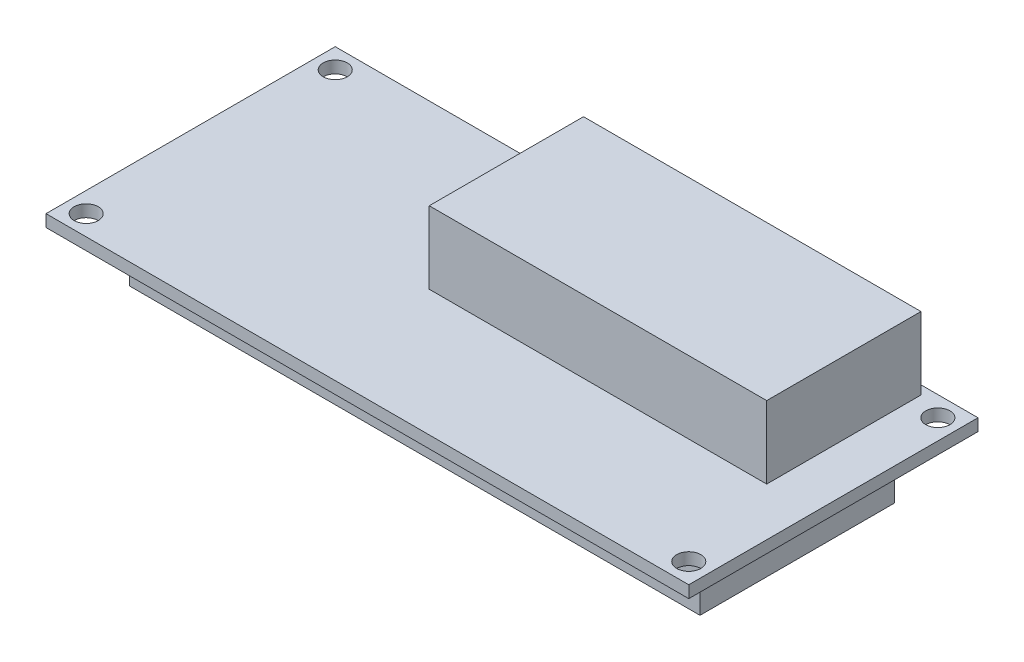
from build123d import *

# Parameters (mm, degrees)
SKETCH_1_W          = 80
SKETCH_1_H          = 36
SKETCH_1_R          = 1.5
EXTRUDE_1_DEPTH     = 1.5
SKETCH_2_W          = 71
SKETCH_2_H          = 24.2
EXTRUDE_2_DEPTH     = 7
SKETCH_3_W          = 42
SKETCH_3_H          = 19.2
EXTRUDE_3_DEPTH     = 9
SKETCH_4_W          = 64.4
SKETCH_4_H          = 14.5
CUT_EXTRUDE_1_DEPTH = 0.1


with BuildPart() as part:
    # Эскиз1 → Бобышка-Вытянуть1 (new body)
    with BuildSketch(Plane(origin=(0, 0, 0), x_dir=(1, 0, 0), z_dir=(0, 1, 0))):
        with Locations((16.363636364, -7.454545455)):
            Rectangle(SKETCH_1_W, SKETCH_1_H)
        with Locations(Location((-21.136363636, -22.954545455, 0), (0, 0, 270))):
            Circle(SKETCH_1_R, mode=Mode.SUBTRACT)
        with Locations(Location((53.863636364, 8.045454545, 0), (0, 0, 270))):
            Circle(SKETCH_1_R, mode=Mode.SUBTRACT)
        with Locations(Location((-21.136363636, 8.045454545, 0), (0, 0, 270))):
            Circle(SKETCH_1_R, mode=Mode.SUBTRACT)
        with Locations(Location((53.863636364, -22.954545455, 0), (0, 0, 270))):
            Circle(SKETCH_1_R, mode=Mode.SUBTRACT)
    extrude(amount=EXTRUDE_1_DEPTH)

    # Эскиз2 → Бобышка-Вытянуть2 (add)
    with BuildSketch(Plane.XZ):
        with Locations((16.363636364, 7.454545455)):
            Rectangle(SKETCH_2_W, SKETCH_2_H)
    extrude(amount=EXTRUDE_2_DEPTH)

    # Эскиз3 → Бобышка-Вытянуть3 (add)
    with BuildSketch(Plane(origin=(0, 1.5, 0), x_dir=(1, 0, 0), z_dir=(0, 1, 0))):
        with Locations((29.363636364, -0.154545455)):
            Rectangle(SKETCH_3_W, SKETCH_3_H)
    extrude(amount=EXTRUDE_3_DEPTH)

    # Эскиз4 → Вырез-Вытянуть1 (cut)
    with BuildSketch(Plane.XZ.offset(7)):
        with Locations((16.363636364, 7.454545455)):
            Rectangle(SKETCH_4_W, SKETCH_4_H)
    extrude(amount=-CUT_EXTRUDE_1_DEPTH, mode=Mode.SUBTRACT)


solid = part.part
